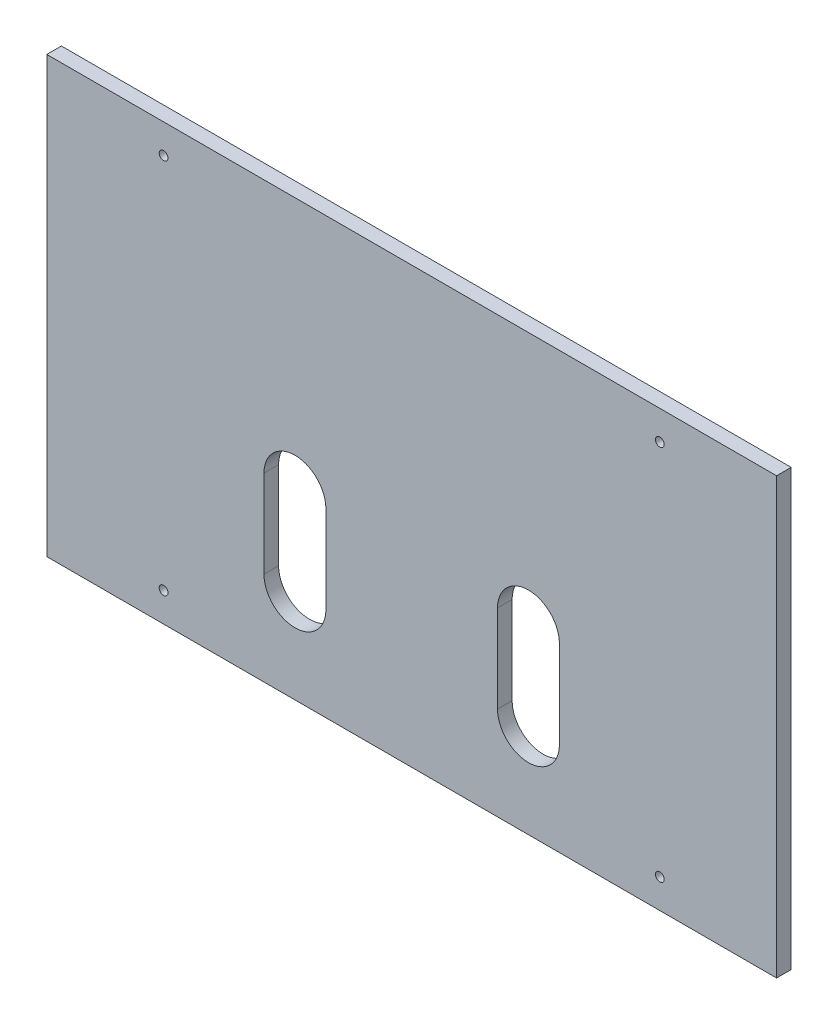
from build123d import *

# Parameters (mm, degrees)
ESQUISSE1_W             = 250
ESQUISSE1_H             = 149
BOSS_EXTRU_1_DEPTH      = 5
ESQUISSE2_R             = 1.5
ENL_V_MAT_EXTRU_1_DEPTH = 5
ENL_V_MAT_EXTRU_2_DEPTH = 5


with BuildPart() as part:
    # Esquisse1 → Boss.-Extru.1 (new body)
    with BuildSketch(Plane.XY):
        Rectangle(ESQUISSE1_W, ESQUISSE1_H)
    extrude(amount=BOSS_EXTRU_1_DEPTH)

    # Esquisse2 → Enlèv. mat.-Extru.1 (cut)
    with BuildSketch(Plane.XY.offset(5)):
        with Locations((-85, 64.5)):
            Circle(ESQUISSE2_R)
        with Locations(Location((-85, -64.5, 0), (0, 0, 180))):
            Circle(ESQUISSE2_R)
        with Locations((85, -64.5)):
            Circle(ESQUISSE2_R)
        with Locations(Location((85, 64.5, 0), (0, 0, 180))):
            Circle(ESQUISSE2_R)
    extrude(amount=-ENL_V_MAT_EXTRU_1_DEPTH, mode=Mode.SUBTRACT)

    # Esquisse3 → Enlèv. mat.-Extru.2 (cut)
    with BuildSketch(Plane.XY.offset(5)):
        with BuildLine():
            Line((-29.4, -12.5), (-29.4, -42.5))
            ThreePointArc((-29.4, -42.5), (-40, -53.1), (-50.6, -42.5))
            Line((-50.6, -42.5), (-50.6, -12.5))
            ThreePointArc((-50.6, -12.5), (-40, -1.9), (-29.4, -12.5))
        make_face()
        with BuildLine():
            Line((29.4, -12.5), (29.4, -42.5))
            ThreePointArc((29.4, -42.5), (40, -53.1), (50.6, -42.5))
            Line((50.6, -42.5), (50.6, -12.5))
            ThreePointArc((50.6, -12.5), (40, -1.9), (29.4, -12.5))
        make_face()
    extrude(amount=-ENL_V_MAT_EXTRU_2_DEPTH, mode=Mode.SUBTRACT)


solid = part.part
